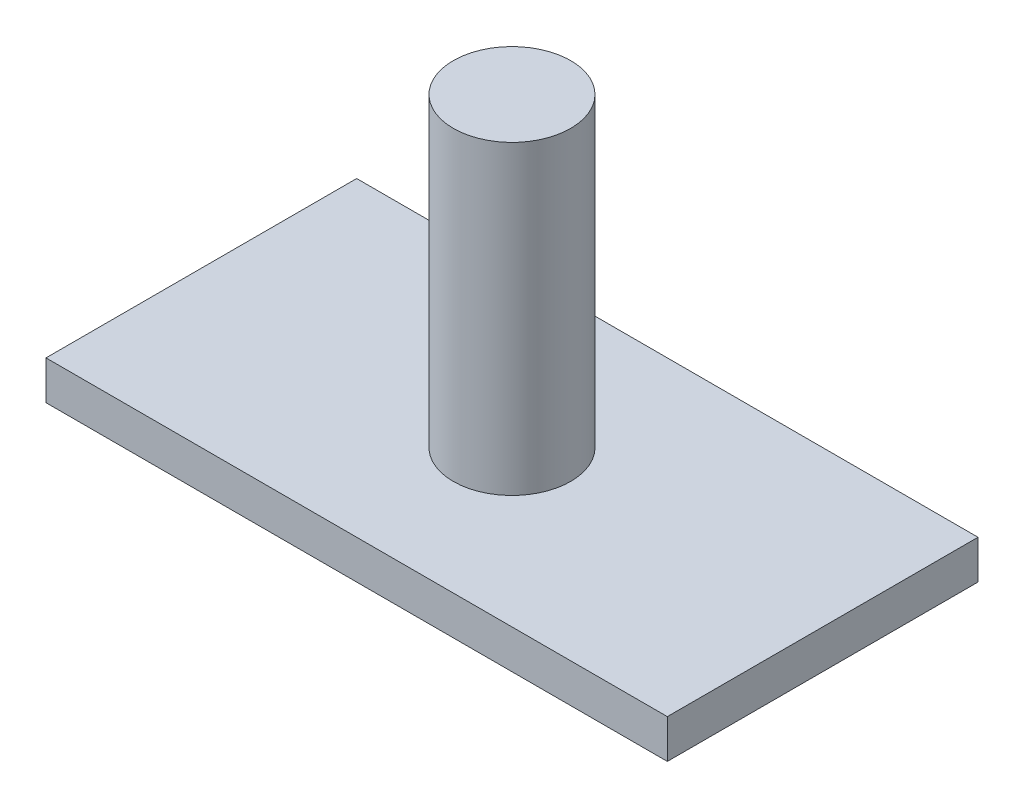
from build123d import *

# Parameters (mm, degrees)
SKETCH1_W           = 50.8
SKETCH1_H           = 25.4
BOSS_EXTRUDE1_DEPTH = 3.175
SKETCH2_R           = 4.8
BOSS_EXTRUDE2_DEPTH = 25


with BuildPart() as part:
    # Sketch1 → Boss-Extrude1 (new body)
    with BuildSketch(Plane(origin=(0, 0, 0), x_dir=(1, 0, 0), z_dir=(0, 1, 0))):
        with Locations((25.4, 12.7)):
            Rectangle(SKETCH1_W, SKETCH1_H)
    extrude(amount=BOSS_EXTRUDE1_DEPTH)

    # Sketch2 → Boss-Extrude2 (add)
    with BuildSketch(Plane(origin=(0, 3.175, 0), x_dir=(1, 0, 0), z_dir=(0, 1, 0))):
        with Locations(Location((25.4, 12.7, 0), (0, 0, 270))):
            Circle(SKETCH2_R)
    extrude(amount=BOSS_EXTRUDE2_DEPTH)


solid = part.part
